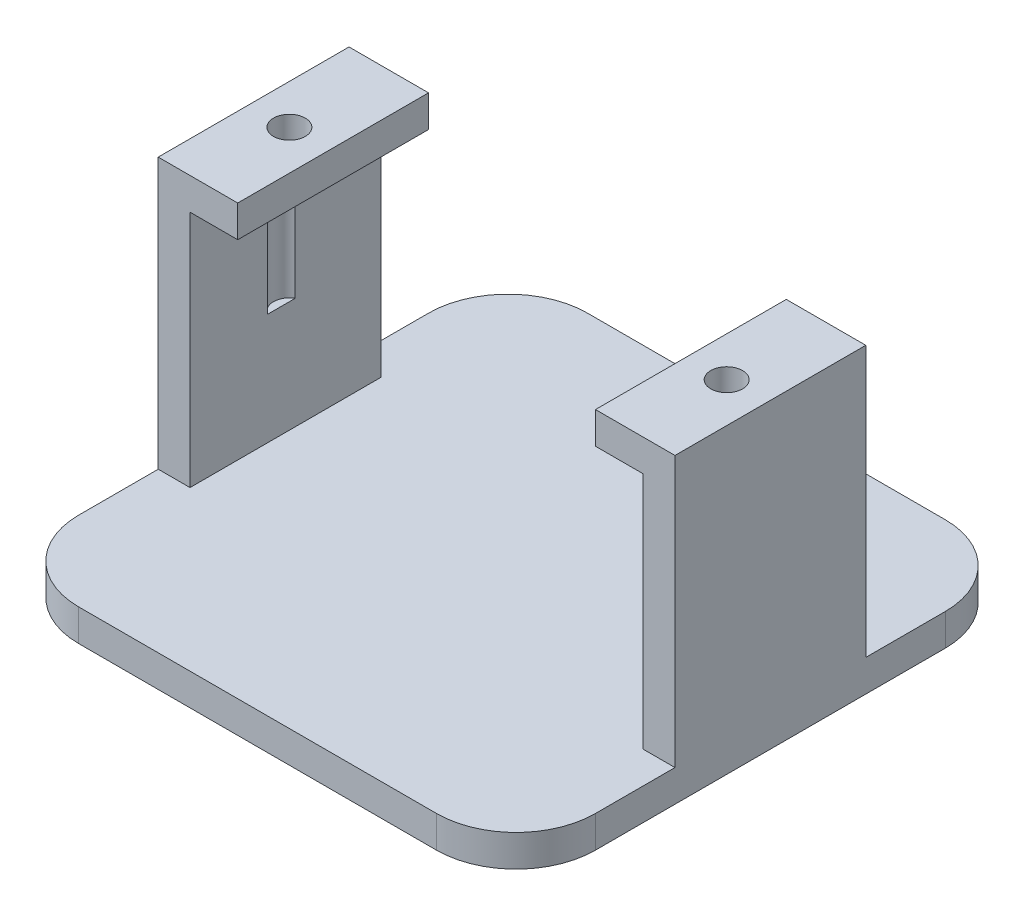
from build123d import *

# Parameters (mm, degrees)
SKETCH1_W           = 32.5
SKETCH1_H           = 12
BOSS_EXTRUDE1_DEPTH = 2
SKETCH2_W           = 2
SKETCH2_H           = 12
BOSS_EXTRUDE2_DEPTH = 17
SKETCH3_W           = 12
SKETCH3_H           = 2
BOSS_EXTRUDE3_DEPTH = 3
SKETCH4_W           = 12
SKETCH4_H           = 2
BOSS_EXTRUDE4_DEPTH = 3
SKETCH5_W           = 32.5
SKETCH5_H           = 2
BOSS_EXTRUDE6_DEPTH = 10
SKETCH7_W           = 32.5
SKETCH7_H           = 2
BOSS_EXTRUDE7_DEPTH = 10
FILLET1_R           = 5
SKETCH8_R           = 1
CUT_EXTRUDE1_DEPTH  = 10


with BuildPart() as part:
    # Sketch1 → Boss-Extrude1 (new body)
    with BuildSketch(Plane(origin=(0, 0, 0), x_dir=(1, 0, 0), z_dir=(0, 1, 0))):
        with Locations((16.25, 6)):
            Rectangle(SKETCH1_W, SKETCH1_H)
    extrude(amount=BOSS_EXTRUDE1_DEPTH)

    # Sketch2 → Boss-Extrude2 (add)
    with BuildSketch(Plane(origin=(0, 2, 0), x_dir=(1, 0, 0), z_dir=(0, 1, 0))):
        with Locations((1, 6)):
            Rectangle(SKETCH2_W, SKETCH2_H)
        with Locations((31.5, 6)):
            Rectangle(SKETCH2_W, SKETCH2_H)
    extrude(amount=BOSS_EXTRUDE2_DEPTH)

    # Sketch3 → Boss-Extrude3 (add)
    with BuildSketch(Plane(origin=(2, 0, 0), x_dir=(0, 0, -1), z_dir=(1, 0, 0))):
        with Locations((6, 18)):
            Rectangle(SKETCH3_W, SKETCH3_H)
    extrude(amount=BOSS_EXTRUDE3_DEPTH)

    # Sketch4 → Boss-Extrude4 (add)
    with BuildSketch(Plane.ZY.offset(-30.5)):
        with Locations((-6, 18)):
            Rectangle(SKETCH4_W, SKETCH4_H)
    extrude(amount=BOSS_EXTRUDE4_DEPTH)

    # Sketch5 → Boss-Extrude6 (add)
    with BuildSketch(Plane(origin=(0, 0, -12), x_dir=(-1, 0, 0), z_dir=(0, 0, -1))):
        with Locations((-16.25, 1)):
            Rectangle(SKETCH5_W, SKETCH5_H)
    extrude(amount=BOSS_EXTRUDE6_DEPTH)

    # Sketch7 → Boss-Extrude7 (add)
    with BuildSketch(Plane.XY):
        with Locations((16.25, 1)):
            Rectangle(SKETCH7_W, SKETCH7_H)
    extrude(amount=BOSS_EXTRUDE7_DEPTH)

    # Fillet1
    fillet1_edges = [part.edges().sort_by_distance(p)[0] for p in [
        (32.5, 1, 10),
        (0, 1, 10),
        (32.5, 1, -22),
        (0, 1, -22),
    ]]
    fillet(fillet1_edges, radius=FILLET1_R)

    # Sketch8 → Cut-Extrude1 (cut)
    with BuildSketch(Plane(origin=(0, 19, 0), x_dir=(1, 0, 0), z_dir=(0, 1, 0))):
        with Locations(Location((2.5, 5.75, 0), (0, 0, 270))):
            Circle(SKETCH8_R)
        with Locations(Location((30, 5.75, 0), (0, 0, 270))):
            Circle(SKETCH8_R)
    extrude(amount=-CUT_EXTRUDE1_DEPTH, mode=Mode.SUBTRACT)


solid = part.part
